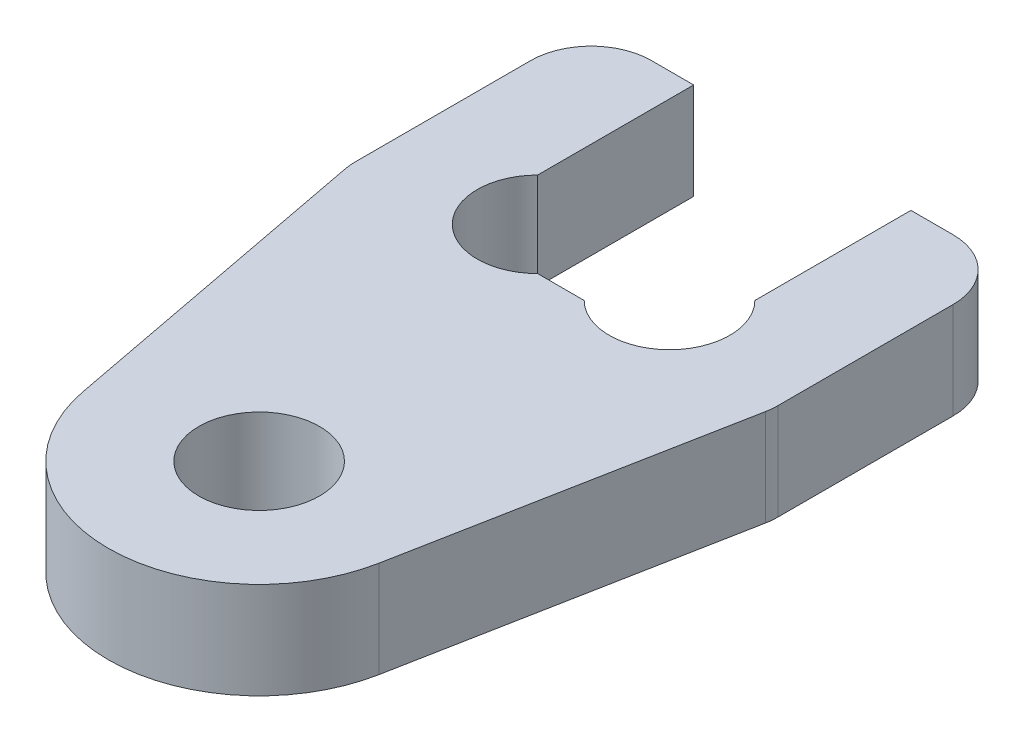
from build123d import *

# Parameters (mm, degrees)
SKETCH1_W               = 7
SKETCH1_H               = 12
BOSS_EXTRUDE1_DEPTH     = 1.6
SKETCH3_W               = 3.6
SKETCH3_H               = 4
CUT_EXTRUDE2_DEPTH      = 8.128113355
SKETCH4_R               = 1
CUT_EXTRUDE3_DEPTH      = 10
CUT_EXTRUDE4_DEPTH      = 8.128113355
CUT_EXTRUDE4_DEPTH_BACK = 8.128113355
FILLET1_R               = 1
CUT_EXTRUDE5_DEPTH      = 8.128113355


with BuildPart() as part:
    # Sketch1 → Boss-Extrude1 (new body)
    with BuildSketch(Plane(origin=(0, 0, 0), x_dir=(1, 0, 0), z_dir=(0, 1, 0))):
        Rectangle(SKETCH1_W, SKETCH1_H)
    extrude(amount=BOSS_EXTRUDE1_DEPTH)

    # Sketch3 → Cut-Extrude2 (cut, through all)
    with BuildSketch(Plane.XZ):
        with Locations((0, -4)):
            Rectangle(SKETCH3_W, SKETCH3_H)
    extrude(amount=-CUT_EXTRUDE2_DEPTH, mode=Mode.SUBTRACT)

    # Sketch4 → Cut-Extrude3 (cut)
    with BuildSketch(Plane(origin=(0, 1.6, 0), x_dir=(1, 0, 0), z_dir=(0, 1, 0))):
        with Locations(Location((0, -3, 0), (0, 0, 270))):
            Circle(SKETCH4_R)
    extrude(amount=-CUT_EXTRUDE3_DEPTH, mode=Mode.SUBTRACT)

    # Sketch5 → Cut-Extrude4 (cut, two sides: drawn at the far end of the back side and taken through both)
    with BuildSketch(Plane(origin=(0, 1.6, 0), x_dir=(1, 0, 0), z_dir=(0, 1, 0)).offset(-CUT_EXTRUDE4_DEPTH_BACK)):
        with BuildLine():
            Line((2.455625625, -3.468937938), (3.5, 2))
            Line((3.5, 2), (6.178310216, -2.368643633))
            Line((6.178310216, -2.368643633), (0.801322839, -12.436782797))
            Line((0.801322839, -12.436782797), (-8.05270341, -5.5))
            Line((-8.05270341, -5.5), (-3.5, 2))
            Line((-3.5, 2), (-2.455625625, -3.468937938))
            ThreePointArc((-2.455625625, -3.468937938), (0, -5.5), (2.455625625, -3.468937938))
        make_face()
    extrude(amount=CUT_EXTRUDE4_DEPTH + CUT_EXTRUDE4_DEPTH_BACK, mode=Mode.SUBTRACT)

    # Fillet1
    fillet1_edges = [part.edges().sort_by_distance(p)[0] for p in [
        (3.5, 0.8, -2),
        (-3.5, 0.8, -2),
        (-3.5, 0.8, -6),
        (3.5, 0.8, -6),
    ]]
    fillet(fillet1_edges, radius=FILLET1_R)

    # Sketch8 → Cut-Extrude5 (cut, through all)
    with BuildSketch(Plane(origin=(0, 1.6, 0), x_dir=(1, 0, 0), z_dir=(0, 1, 0))):
        with BuildLine():
            Line((1.8, 3.414213562), (0.385786438, 2))
            ThreePointArc((0.385786438, 2), (1.8, 2), (1.8, 3.414213562))
        make_face()
        with BuildLine():
            Line((-1.8, 3.414213562), (-0.385786438, 2))
            ThreePointArc((-0.385786438, 2), (-1.8, 2), (-1.8, 3.414213562))
        make_face()
    extrude(amount=-CUT_EXTRUDE5_DEPTH, mode=Mode.SUBTRACT)


solid = part.part
